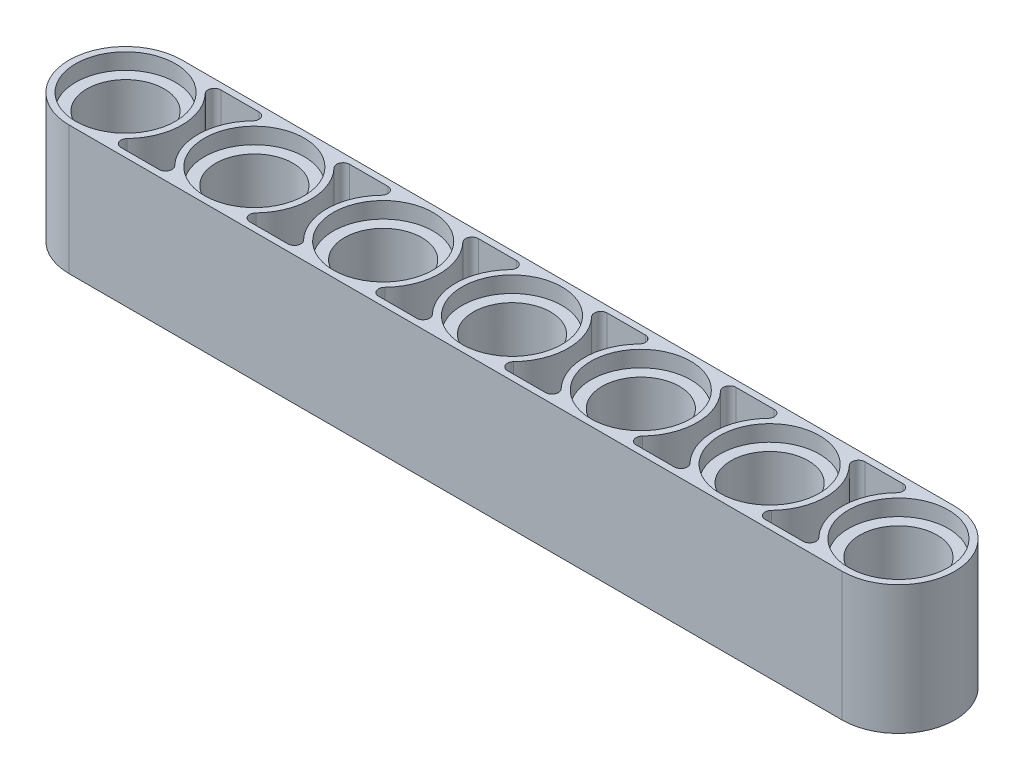
from build123d import *

# Parameters (mm, degrees)
BOSS_EXTRUDE1_DEPTH = 8
SKETCH5_R           = 3.1
CUT_EXTRUDE1_DEPTH  = 1
SKETCH6_R           = 2.4
CUT_EXTRUDE2_DEPTH  = 53.091266063
CUT_EXTRUDE3_START  = -1
SKETCH8_R           = 3.1
CUT_EXTRUDE3_DEPTH  = 1
LPATTERN3_COUNT     = 7
LPATTERN3_PITCH     = 8
CUT_EXTRUDE4_DEPTH  = 53.235045707
LPATTERN4_COUNT     = 6
LPATTERN4_PITCH     = 8


with BuildPart() as part:
    # Sketch3 → Boss-Extrude1 (new body)
    with BuildSketch(Plane(origin=(0, 0, 0), x_dir=(1, 0, 0), z_dir=(0, 1, 0))):
        with BuildLine():
            Line((0, 3.5), (48, 3.5))
            ThreePointArc((48, 3.5), (51.5, 0), (48, -3.5))
            Line((48, -3.5), (0, -3.5))
            ThreePointArc((0, -3.5), (-3.5, 0), (0, 3.5))
        make_face()
    extrude(amount=BOSS_EXTRUDE1_DEPTH)

    # Sketch5 → Cut-Extrude1 (cut)
    with BuildSketch(Plane(origin=(0, 0, 0), x_dir=(-1, 0, 0), z_dir=(0, -1, 0))):
        with Locations(Location((0, 0, 0), (0, 0, 90))):
            Circle(SKETCH5_R)
    cut_extrude1 = extrude(amount=-CUT_EXTRUDE1_DEPTH, mode=Mode.SUBTRACT)

    # Sketch6 → Cut-Extrude2 (cut, symmetric)
    with BuildSketch(Plane(origin=(0, 1, 0), x_dir=(-1, 0, 0), z_dir=(0, -1, 0))):
        with Locations(Location((0, 0, 0), (0, 0, 90))):
            Circle(SKETCH6_R)
    cut_extrude2 = extrude(amount=CUT_EXTRUDE2_DEPTH, both=True, mode=Mode.SUBTRACT)

    # Sketch8 → Cut-Extrude3 (cut)
    with BuildSketch(Plane(origin=(0, 8, 0), x_dir=(1, 0, 0), z_dir=(0, 1, 0)).offset(CUT_EXTRUDE3_START)):
        with Locations(Location((0, 0, 0), (0, 0, 90))):
            Circle(SKETCH8_R)
    cut_extrude3 = extrude(amount=CUT_EXTRUDE3_DEPTH, mode=Mode.SUBTRACT)

    # LPattern3: Cut-Extrude1, Cut-Extrude2, Cut-Extrude3 ×7
    with Locations(*[(i * LPATTERN3_PITCH, 0, 0) for i in range(1, LPATTERN3_COUNT)]):
        add(cut_extrude1, mode=Mode.SUBTRACT)
        add(cut_extrude2, mode=Mode.SUBTRACT)
        add(cut_extrude3, mode=Mode.SUBTRACT)

    # Sketch9 → Cut-Extrude4 (cut, symmetric)
    with BuildSketch(Plane(origin=(0, 8, 0), x_dir=(1, 0, 0), z_dir=(0, 1, 0))):
        with BuildLine():
            Line((2.814249456, 3.1), (5.185750544, 3.1))
            ThreePointArc((5.185750544, 3.1), (5.553697029, 2.856892908), (5.474391514, 2.423076923))
            ThreePointArc((5.474391514, 2.423076923), (4.5, 0), (5.474391514, -2.423076923))
            ThreePointArc((5.474391514, -2.423076923), (5.553697029, -2.856892908), (5.185750544, -3.1))
            Line((5.185750544, -3.1), (2.814249456, -3.1))
            ThreePointArc((2.814249456, -3.1), (2.446302971, -2.856892908), (2.525608486, -2.423076923))
            ThreePointArc((2.525608486, -2.423076923), (3.5, 0), (2.525608486, 2.423076923))
            ThreePointArc((2.525608486, 2.423076923), (2.446302971, 2.856892908), (2.814249456, 3.1))
        make_face()
    cut_extrude4 = extrude(amount=CUT_EXTRUDE4_DEPTH, both=True, mode=Mode.SUBTRACT)

    # LPattern4: Cut-Extrude4 ×6
    with Locations(*[(i * LPATTERN4_PITCH, 0, 0) for i in range(1, LPATTERN4_COUNT)]):
        add(cut_extrude4, mode=Mode.SUBTRACT)


solid = part.part
